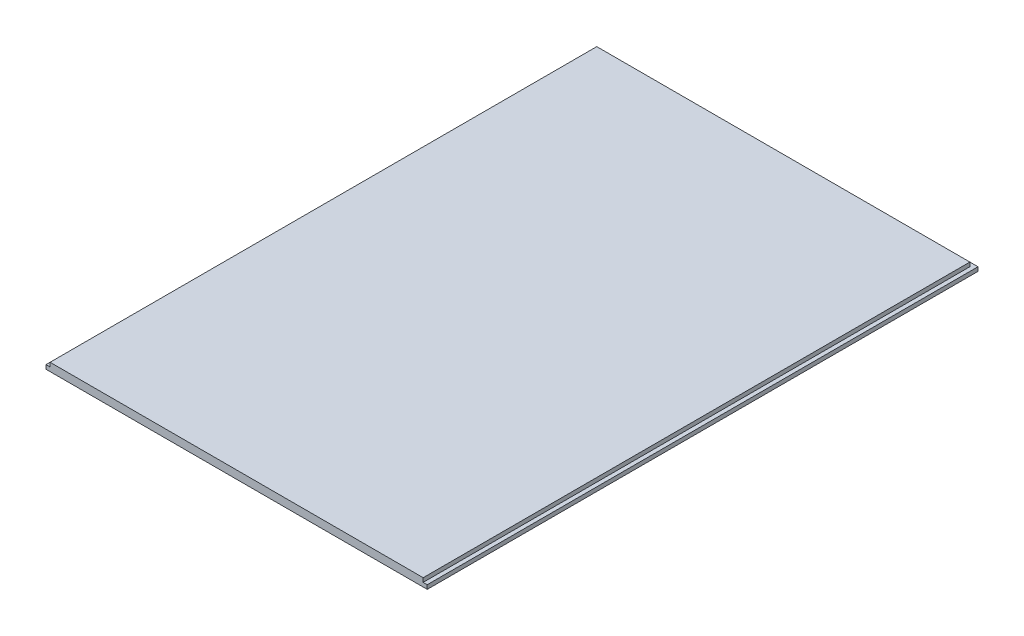
from build123d import *

# Parameters (mm, degrees)
SKETCH1_W               = 298.45
SKETCH1_H               = 431.165
BOSS_EXTRUDE1_DEPTH     = 6.35
CUT_EXTRUDE1_DEPTH      = 525.419662317
CUT_EXTRUDE1_DEPTH_BACK = 3.175


with BuildPart() as part:
    # Sketch1 → Boss-Extrude1 (new body)
    with BuildSketch(Plane(origin=(0, 0, 0), x_dir=(1, 0, 0), z_dir=(0, 1, 0))):
        with Locations((149.225, 215.5825)):
            Rectangle(SKETCH1_W, SKETCH1_H)
    extrude(amount=BOSS_EXTRUDE1_DEPTH)

    # Sketch2 → Cut-Extrude1 (cut, two sides: drawn at the far end of the back side and taken through both)
    with BuildSketch(Plane(origin=(0, 6.35, 0), x_dir=(1, 0, 0), z_dir=(0, 1, 0)).offset(-CUT_EXTRUDE1_DEPTH_BACK)):
        Polygon((0, 0), (3.175, 0), (3.175, 427.99), (295.275, 427.99), (295.275, 0), (298.45, 0), (298.45, 431.165), (0, 431.165), align=None)
    extrude(amount=CUT_EXTRUDE1_DEPTH + CUT_EXTRUDE1_DEPTH_BACK, mode=Mode.SUBTRACT)


solid = part.part
